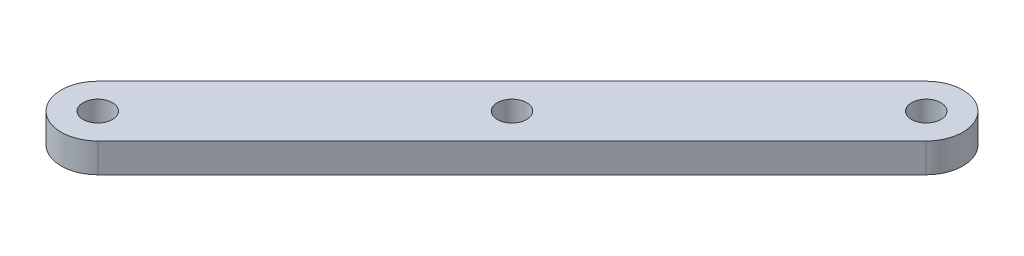
from build123d import *

# Parameters (mm, degrees)
SKETCH1_R           = 5
BOSS_EXTRUDE1_DEPTH = 10


with BuildPart() as part:
    # Sketch1 → Boss-Extrude1 (new body)
    with BuildSketch(Plane(origin=(0, 0, 0), x_dir=(1, 0, 0), z_dir=(0, 1, 0))):
        with BuildLine():
            Line((-8.838834765, 8.838834765), (132.582521472, 150.260191002))
            ThreePointArc((132.582521472, 150.260191002), (150.260191002, 150.260191002), (150.260191002, 132.582521472))
            Line((150.260191002, 132.582521472), (8.838834765, -8.838834765))
            ThreePointArc((8.838834765, -8.838834765), (-8.838834765, -8.838834765), (-8.838834765, 8.838834765))
        make_face()
        with Locations(Location((0, 0, 0), (0, 0, 270))):
            Circle(SKETCH1_R, mode=Mode.SUBTRACT)
        with Locations(Location((141.421356237, 141.421356237, 0), (0, 0, 270))):
            Circle(SKETCH1_R, mode=Mode.SUBTRACT)
        with Locations(Location((70.710678119, 70.710678119, 0), (0, 0, 270))):
            Circle(SKETCH1_R, mode=Mode.SUBTRACT)
    extrude(amount=BOSS_EXTRUDE1_DEPTH)


solid = part.part
